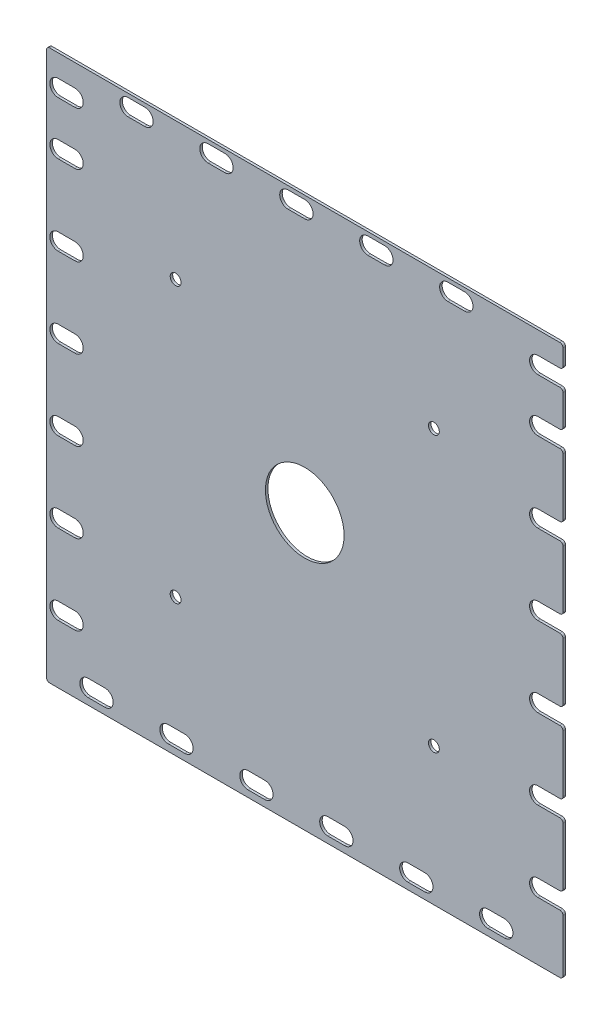
from build123d import *

# Parameters (mm, degrees)
SKETCH1_W               = 164.1
SKETCH1_H               = 174.745
SKETCH1_R               = 12.5
BOSS_EXTRUDE1_DEPTH     = 0.8
FILLET1_R               = 1
CUT_EXTRUDE1_DEPTH      = 241.06169004
CUT_EXTRUDE1_DEPTH_BACK = 241.06169004
SKETCH2_R               = 1.725
SKETCH2_W               = 2.675
SKETCH2_H               = 5.3
FILLET2_R               = 1


with BuildPart() as part:
    # Sketch1 → Boss-Extrude1 (new body)
    with BuildSketch(Plane.XY):
        with Locations((82.55, -87.3725)):
            Rectangle(SKETCH1_W, SKETCH1_H)
        with Locations((82.55, -87.3725)):
            Circle(SKETCH1_R, mode=Mode.SUBTRACT)
        with BuildLine():
            Line((82.55, -6.5), (77.25, -6.5))
            ThreePointArc((77.25, -6.5), (74.6, -3.85), (77.25, -1.2))
            Line((77.25, -1.2), (82.55, -1.2))
            ThreePointArc((82.55, -1.2), (85.2, -3.85), (82.55, -6.5))
        make_face(mode=Mode.SUBTRACT)
        with BuildLine():
            Line((13.75, -167.3325), (19.05, -167.3325))
            ThreePointArc((19.05, -167.3325), (21.7, -169.9825), (19.05, -172.6325))
            Line((19.05, -172.6325), (13.75, -172.6325))
            ThreePointArc((13.75, -172.6325), (11.1, -169.9825), (13.75, -167.3325))
        make_face(mode=Mode.SUBTRACT)
        with BuildLine():
            Line((4.225, -150.87), (9.525, -150.87))
            ThreePointArc((9.525, -150.87), (12.175, -153.52), (9.525, -156.17))
            Line((9.525, -156.17), (4.225, -156.17))
            ThreePointArc((4.225, -156.17), (1.575, -153.52), (4.225, -150.87))
        make_face(mode=Mode.SUBTRACT)
        with BuildLine():
            Line((39.15, -167.3325), (44.45, -167.3325))
            ThreePointArc((44.45, -167.3325), (47.1, -169.9825), (44.45, -172.6325))
            Line((44.45, -172.6325), (39.15, -172.6325))
            ThreePointArc((39.15, -172.6325), (36.5, -169.9825), (39.15, -167.3325))
        make_face(mode=Mode.SUBTRACT)
        with BuildLine():
            Line((64.55, -167.3325), (69.85, -167.3325))
            ThreePointArc((69.85, -167.3325), (72.5, -169.9825), (69.85, -172.6325))
            Line((69.85, -172.6325), (64.55, -172.6325))
            ThreePointArc((64.55, -172.6325), (61.9, -169.9825), (64.55, -167.3325))
        make_face(mode=Mode.SUBTRACT)
        with BuildLine():
            Line((4.225, -125.47), (9.525, -125.47))
            ThreePointArc((9.525, -125.47), (12.175, -128.12), (9.525, -130.77))
            Line((9.525, -130.77), (4.225, -130.77))
            ThreePointArc((4.225, -130.77), (1.575, -128.12), (4.225, -125.47))
        make_face(mode=Mode.SUBTRACT)
        with BuildLine():
            Line((4.225, -100.07), (9.525, -100.07))
            ThreePointArc((9.525, -100.07), (12.175, -102.72), (9.525, -105.37))
            Line((9.525, -105.37), (4.225, -105.37))
            ThreePointArc((4.225, -105.37), (1.575, -102.72), (4.225, -100.07))
        make_face(mode=Mode.SUBTRACT)
        with BuildLine():
            Line((4.225, -74.67), (9.525, -74.67))
            ThreePointArc((9.525, -74.67), (12.175, -77.32), (9.525, -79.97))
            Line((9.525, -79.97), (4.225, -79.97))
            ThreePointArc((4.225, -79.97), (1.575, -77.32), (4.225, -74.67))
        make_face(mode=Mode.SUBTRACT)
        with BuildLine():
            Line((4.225, -49.27), (9.525, -49.27))
            ThreePointArc((9.525, -49.27), (12.175, -51.92), (9.525, -54.57))
            Line((9.525, -54.57), (4.225, -54.57))
            ThreePointArc((4.225, -54.57), (1.575, -51.92), (4.225, -49.27))
        make_face(mode=Mode.SUBTRACT)
        with BuildLine():
            Line((4.225, -23.87), (9.525, -23.87))
            ThreePointArc((9.525, -23.87), (12.175, -26.52), (9.525, -29.17))
            Line((9.525, -29.17), (4.225, -29.17))
            ThreePointArc((4.225, -29.17), (1.575, -26.52), (4.225, -23.87))
        make_face(mode=Mode.SUBTRACT)
        with BuildLine():
            Line((4.225, -7.0375), (9.525, -7.0375))
            ThreePointArc((9.525, -7.0375), (12.175, -9.6875), (9.525, -12.3375))
            Line((9.525, -12.3375), (4.225, -12.3375))
            ThreePointArc((4.225, -12.3375), (1.575, -9.6875), (4.225, -7.0375))
        make_face(mode=Mode.SUBTRACT)
        with BuildLine():
            Line((26.45, -1.2), (31.75, -1.2))
            ThreePointArc((31.75, -1.2), (34.4, -3.85), (31.75, -6.5))
            Line((31.75, -6.5), (26.45, -6.5))
            ThreePointArc((26.45, -6.5), (23.8, -3.85), (26.45, -1.2))
        make_face(mode=Mode.SUBTRACT)
        with BuildLine():
            Line((51.85, -1.2), (57.15, -1.2))
            ThreePointArc((57.15, -1.2), (59.8, -3.85), (57.15, -6.5))
            Line((57.15, -6.5), (51.85, -6.5))
            ThreePointArc((51.85, -6.5), (49.2, -3.85), (51.85, -1.2))
        make_face(mode=Mode.SUBTRACT)
        with BuildLine():
            ThreePointArc((161.925, -7.0375), (164.575, -9.6875), (161.925, -12.3375))
            Line((161.925, -12.3375), (156.625, -12.3375))
            ThreePointArc((156.625, -12.3375), (153.975, -9.6875), (156.625, -7.0375))
            Line((156.625, -7.0375), (161.925, -7.0375))
        make_face(mode=Mode.SUBTRACT)
        with BuildLine():
            Line((89.95, -167.3325), (95.25, -167.3325))
            ThreePointArc((95.25, -167.3325), (97.9, -169.9825), (95.25, -172.6325))
            Line((95.25, -172.6325), (89.95, -172.6325))
            ThreePointArc((89.95, -172.6325), (87.3, -169.9825), (89.95, -167.3325))
        make_face(mode=Mode.SUBTRACT)
        with BuildLine():
            Line((115.35, -167.3325), (120.65, -167.3325))
            ThreePointArc((120.65, -167.3325), (123.3, -169.9825), (120.65, -172.6325))
            Line((120.65, -172.6325), (115.35, -172.6325))
            ThreePointArc((115.35, -172.6325), (112.7, -169.9825), (115.35, -167.3325))
        make_face(mode=Mode.SUBTRACT)
        with BuildLine():
            Line((140.75, -167.3325), (146.05, -167.3325))
            ThreePointArc((146.05, -167.3325), (148.7, -169.9825), (146.05, -172.6325))
            Line((146.05, -172.6325), (140.75, -172.6325))
            ThreePointArc((140.75, -172.6325), (138.1, -169.9825), (140.75, -167.3325))
        make_face(mode=Mode.SUBTRACT)
        with BuildLine():
            Line((156.625, -150.87), (161.925, -150.87))
            ThreePointArc((161.925, -150.87), (164.575, -153.52), (161.925, -156.17))
            Line((161.925, -156.17), (156.625, -156.17))
            ThreePointArc((156.625, -156.17), (153.975, -153.52), (156.625, -150.87))
        make_face(mode=Mode.SUBTRACT)
        with BuildLine():
            Line((156.625, -125.47), (161.925, -125.47))
            ThreePointArc((161.925, -125.47), (164.575, -128.12), (161.925, -130.77))
            Line((161.925, -130.77), (156.625, -130.77))
            ThreePointArc((156.625, -130.77), (153.975, -128.12), (156.625, -125.47))
        make_face(mode=Mode.SUBTRACT)
        with BuildLine():
            Line((156.625, -100.07), (161.925, -100.07))
            ThreePointArc((161.925, -100.07), (164.575, -102.72), (161.925, -105.37))
            Line((161.925, -105.37), (156.625, -105.37))
            ThreePointArc((156.625, -105.37), (153.975, -102.72), (156.625, -100.07))
        make_face(mode=Mode.SUBTRACT)
        with BuildLine():
            Line((156.625, -74.67), (161.925, -74.67))
            ThreePointArc((161.925, -74.67), (164.575, -77.32), (161.925, -79.97))
            Line((161.925, -79.97), (156.625, -79.97))
            ThreePointArc((156.625, -79.97), (153.975, -77.32), (156.625, -74.67))
        make_face(mode=Mode.SUBTRACT)
        with BuildLine():
            Line((156.625, -49.27), (161.925, -49.27))
            ThreePointArc((161.925, -49.27), (164.575, -51.92), (161.925, -54.57))
            Line((161.925, -54.57), (156.625, -54.57))
            ThreePointArc((156.625, -54.57), (153.975, -51.92), (156.625, -49.27))
        make_face(mode=Mode.SUBTRACT)
        with BuildLine():
            Line((102.65, -1.2), (107.95, -1.2))
            ThreePointArc((107.95, -1.2), (110.6, -3.85), (107.95, -6.5))
            Line((107.95, -6.5), (102.65, -6.5))
            ThreePointArc((102.65, -6.5), (100, -3.85), (102.65, -1.2))
        make_face(mode=Mode.SUBTRACT)
        with BuildLine():
            Line((156.625, -23.87), (161.925, -23.87))
            ThreePointArc((161.925, -23.87), (164.575, -26.52), (161.925, -29.17))
            Line((161.925, -29.17), (156.625, -29.17))
            ThreePointArc((156.625, -29.17), (153.975, -26.52), (156.625, -23.87))
        make_face(mode=Mode.SUBTRACT)
        with BuildLine():
            Line((128.05, -1.2), (133.35, -1.2))
            ThreePointArc((133.35, -1.2), (136, -3.85), (133.35, -6.5))
            Line((133.35, -6.5), (128.05, -6.5))
            ThreePointArc((128.05, -6.5), (125.4, -3.85), (128.05, -1.2))
        make_face(mode=Mode.SUBTRACT)
    extrude(amount=BOSS_EXTRUDE1_DEPTH)

    # Fillet1
    fillet1_edges = [part.edges().sort_by_distance(p)[0] for p in [
        (0.5, -174.745, 0.4),
        (0.5, 0, 0.4),
        (164.6, 0, 0.4),
        (164.6, -174.745, 0.4),
    ]]
    fillet(fillet1_edges, radius=FILLET1_R)

    # Sketch2 → Cut-Extrude1 (cut, two sides: drawn at the far end of the back side and taken through both)
    with BuildSketch(Plane.XY.offset(0.8).offset(-CUT_EXTRUDE1_DEPTH_BACK)):
        with Locations((41.525, -43.68625)):
            Circle(SKETCH2_R)
        with Locations((123.575, -43.68625)):
            Circle(SKETCH2_R)
        with Locations((123.575, -131.05875)):
            Circle(SKETCH2_R)
        with Locations((41.525, -131.05875)):
            Circle(SKETCH2_R)
        with Locations((163.2625, -9.6875)):
            Rectangle(SKETCH2_W, SKETCH2_H)
        with Locations((163.2625, -51.92)):
            Rectangle(SKETCH2_W, SKETCH2_H)
        with Locations((163.2625, -26.52)):
            Rectangle(SKETCH2_W, SKETCH2_H)
        with Locations((163.2625, -77.32)):
            Rectangle(SKETCH2_W, SKETCH2_H)
        with Locations((163.2625, -102.72)):
            Rectangle(SKETCH2_W, SKETCH2_H)
        with Locations((163.2625, -128.12)):
            Rectangle(SKETCH2_W, SKETCH2_H)
        with Locations((163.2625, -153.52)):
            Rectangle(SKETCH2_W, SKETCH2_H)
    extrude(amount=CUT_EXTRUDE1_DEPTH + CUT_EXTRUDE1_DEPTH_BACK, mode=Mode.SUBTRACT)

    # Fillet2
    fillet2_edges = [part.edges().sort_by_distance(p)[0] for p in [
        (164.6, -100.07, 0.4),
        (164.6, -105.37, 0.4),
        (164.6, -74.67, 0.4),
        (164.6, -79.97, 0.4),
        (164.6, -49.27, 0.4),
        (164.6, -54.57, 0.4),
        (164.6, -23.87, 0.4),
        (164.6, -29.17, 0.4),
        (164.6, -7.0375, 0.4),
        (164.6, -12.3375, 0.4),
        (164.6, -125.47, 0.4),
        (164.6, -130.77, 0.4),
        (164.6, -150.87, 0.4),
        (164.6, -156.17, 0.4),
    ]]
    fillet(fillet2_edges, radius=FILLET2_R)


solid = part.part
